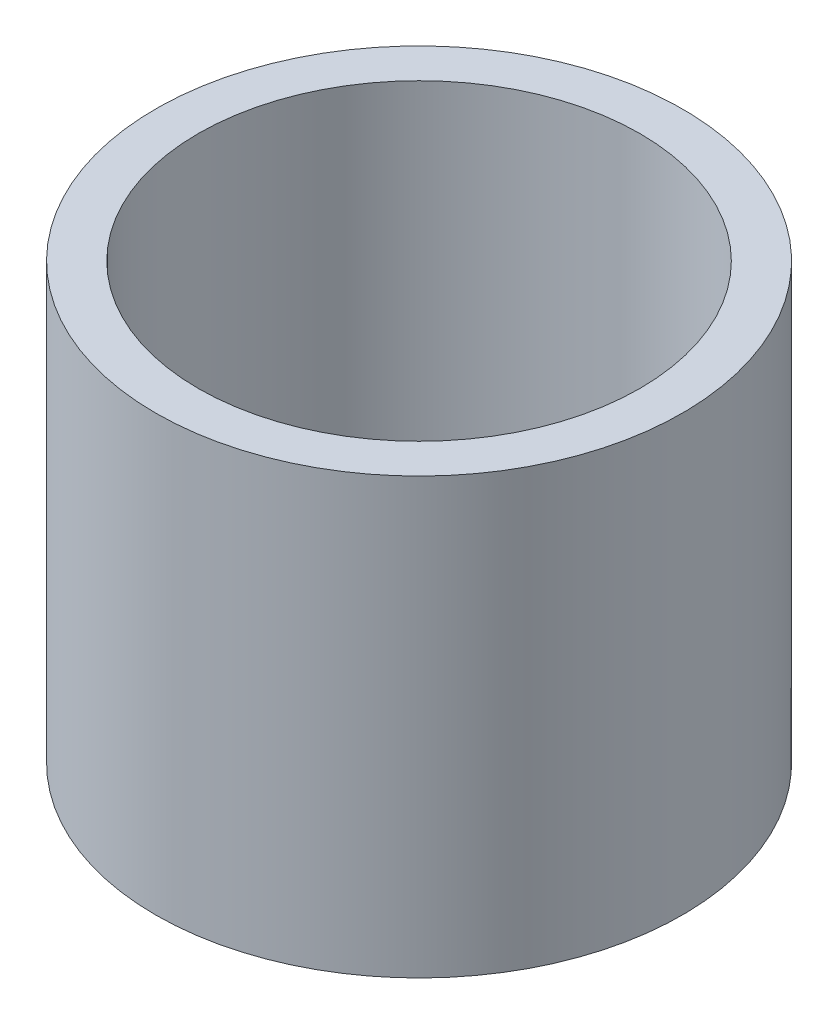
from build123d import *

# Parameters (mm, degrees)
SKETCH1_R           = 30.3
SKETCH1_R_2         = 25.4
BOSS_EXTRUDE1_DEPTH = 50


with BuildPart() as part:
    # Sketch1 → Boss-Extrude1 (new body)
    with BuildSketch(Plane(origin=(0, 0, 0), x_dir=(1, 0, 0), z_dir=(0, 1, 0))):
        with Locations(Location((0, 0, 0), (0, 0, 270))):
            Circle(SKETCH1_R)
        with Locations(Location((0, 0, 0), (0, 0, 270))):
            Circle(SKETCH1_R_2, mode=Mode.SUBTRACT)
    extrude(amount=BOSS_EXTRUDE1_DEPTH)


solid = part.part
